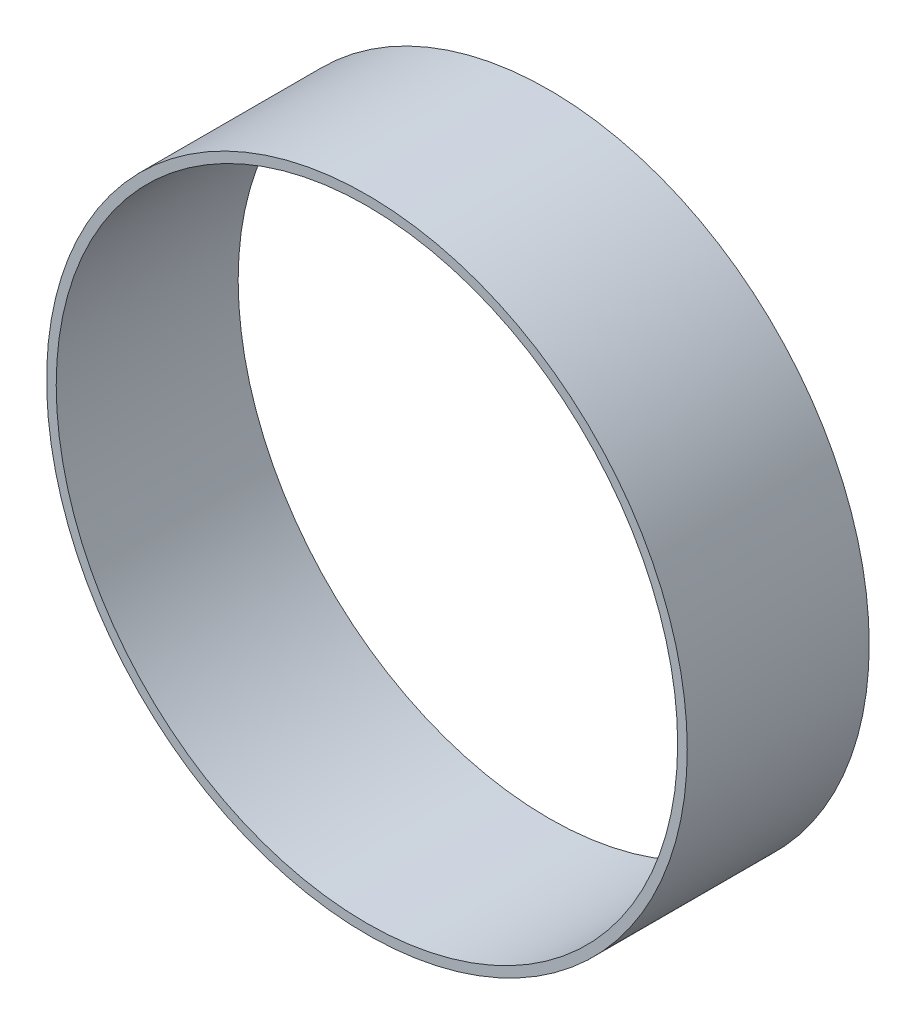
from build123d import *

# Parameters (mm, degrees)
SKETCH1_R           = 50
SKETCH1_R_2         = 48.5
BOSS_EXTRUDE1_DEPTH = 28.4


with BuildPart() as part:
    # Sketch1 → Boss-Extrude1 (new body)
    with BuildSketch(Plane.XY):
        Circle(SKETCH1_R)
        Circle(SKETCH1_R_2, mode=Mode.SUBTRACT)
    extrude(amount=BOSS_EXTRUDE1_DEPTH)


solid = part.part
